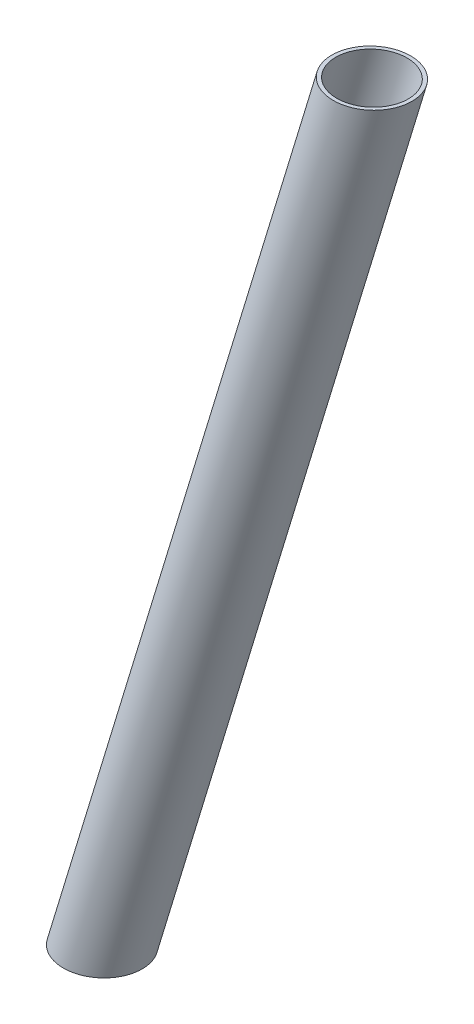
from build123d import *

# Parameters (mm, degrees)
SKETCH4_RX  = 8
SKETCH4_RY  = 7.72
SKETCH10_RX = 8
SKETCH10_RY = 7.72
SKETCH7_RX  = 7.2331319
SKETCH7_RY  = 7.000009729


with BuildPart() as part:
    # Sketch4 → Loft1 section 0
    with BuildSketch(Plane(origin=(0, 176.98, 0), x_dir=(1, 0, 0), z_dir=(0, 1, 0))):
        with Locations(Location((61.863084002, 0), (0, 0, 0))):
            Ellipse(SKETCH4_RX, SKETCH4_RY)
    # Sketch10 → Loft1 section 1
    with BuildSketch(Plane(origin=(0, 0, 0), x_dir=(1, 0, 0), z_dir=(0, 1, 0))):
        with Locations(Location((7.988329, 0), (0, 0, -180))):
            Ellipse(SKETCH10_RX, SKETCH10_RY)
    loft()

    # Cut-Sweep1: sweep along a path in Sketch12
    with BuildLine(Plane.XY) as cut_sweep1_path:
        Line((61.863084002, 176.98), (7.988329, 0))
    # Sketch7 → Cut-Sweep1 (sweep, cut)
    with BuildSketch(Plane(origin=(0, 176.98, 0), x_dir=(1, 0, 0), z_dir=(0, 1, 0))):
        with Locations(Location((61.863084002, 0), (0, 0, -179.904471672))):
            Ellipse(SKETCH7_RX, SKETCH7_RY)
    sweep(path=cut_sweep1_path.line, mode=Mode.SUBTRACT)


solid = part.part
